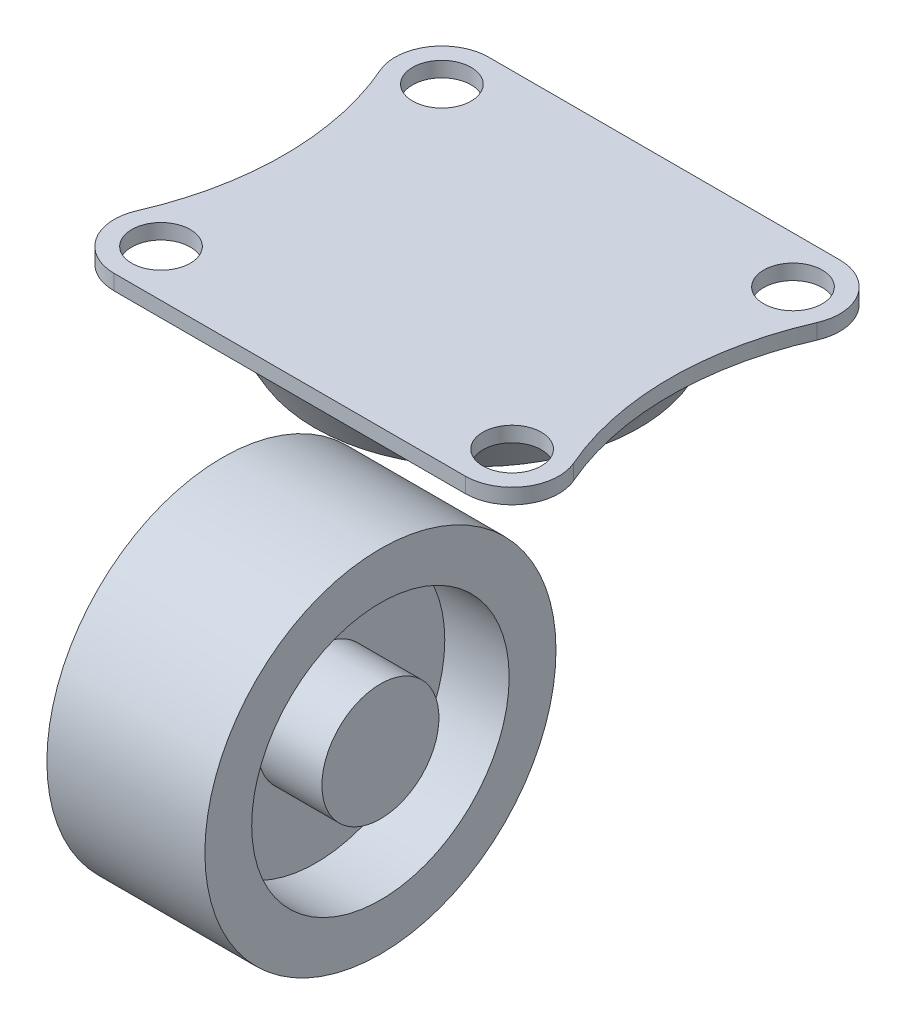
from build123d import *

# Parameters (mm, degrees)
SKETCH1_R           = 2.5
BOSS_EXTRUDE1_DEPTH = 1.3
SKETCH2_R           = 16
BOSS_EXTRUDE2_DEPTH = 3.7
BOSS_EXTRUDE2_TAPER = 30


with BuildPart() as part:
    # Sketch1 → Boss-Extrude1 (new body)
    with BuildSketch(Plane(origin=(0, 0, 0), x_dir=(1, 0, 0), z_dir=(0, 1, 0))):
        with BuildLine():
            Line((-15, 16), (15, 16))
            ThreePointArc((15, 16), (18.345844518, 14.192105029), (18.667221298, 10.40266223))
            ThreePointArc((18.667221298, 10.40266223), (16.5, 0), (18.667221298, -10.40266223))
            ThreePointArc((18.667221298, -10.40266223), (18.345844518, -14.192105029), (15, -16))
            Line((15, -16), (-15, -16))
            ThreePointArc((-15, -16), (-18.345844518, -14.192105029), (-18.667221298, -10.40266223))
            ThreePointArc((-18.667221298, -10.40266223), (-16.5, 0), (-18.667221298, 10.40266223))
            ThreePointArc((-18.667221298, 10.40266223), (-18.345844518, 14.192105029), (-15, 16))
        make_face()
        with Locations(Location((-15, 12, 0), (0, 0, 270))):
            Circle(SKETCH1_R, mode=Mode.SUBTRACT)
        with Locations(Location((15, 12, 0), (0, 0, 90))):
            Circle(SKETCH1_R, mode=Mode.SUBTRACT)
        with Locations(Location((15, -12, 0), (0, 0, 270))):
            Circle(SKETCH1_R, mode=Mode.SUBTRACT)
        with Locations(Location((-15, -12, 0), (0, 0, 90))):
            Circle(SKETCH1_R, mode=Mode.SUBTRACT)
    extrude(amount=BOSS_EXTRUDE1_DEPTH)

    # Sketch2 → Boss-Extrude2 (add)
    with BuildSketch(Plane.XZ):
        Circle(SKETCH2_R)
    extrude(amount=BOSS_EXTRUDE2_DEPTH, taper=BOSS_EXTRUDE2_TAPER)


with BuildPart() as body_2:
    # Sketch4 → Revolve1 (revolve)
    with BuildSketch(Plane(origin=(0, -23.7, 0), x_dir=(-1, 0, 0), z_dir=(0, -1, 0)), mode=Mode.PRIVATE) as revolve1_sk:
        Polygon((6.75, 0), (6.75, -4), (1.25, -4), (1.25, -10), (6.75, -10), (6.75, -15), (-6.75, -15), (-6.75, -10), (-1.25, -10), (-1.25, -4), (-6.75, -4), (-6.75, 0), align=None)
    revolve(revolve1_sk.sketch.rotate(Axis((-7.63674602, -23.7, 15), (1, 0, 0)), 180), axis=Axis((-7.63674602, -23.7, 15), (1, 0, 0)))


solid = Compound([part.part, body_2.part])
